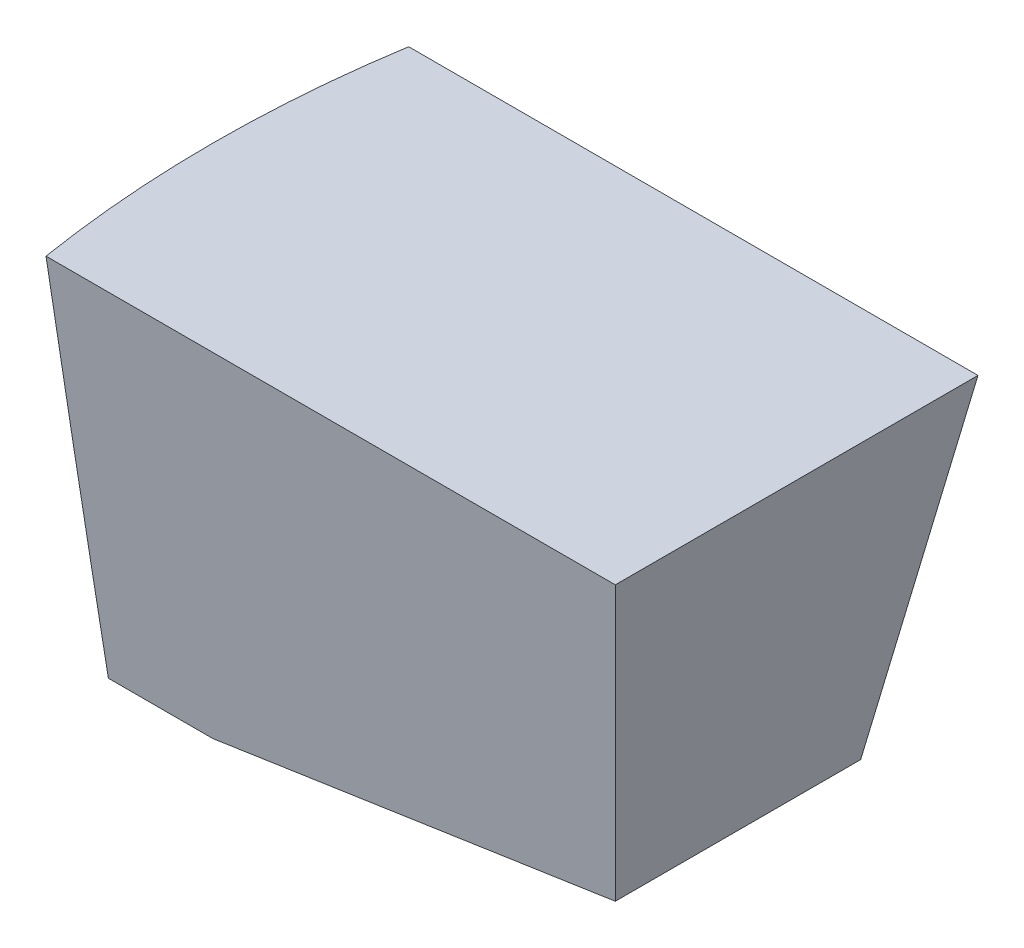
from build123d import *

# Parameters (mm, degrees)
TD_SKETCH_R                           = 0.79248
TL_FEATURE_DEPTH                      = 21.0312
TDF_180_DEG_REV_SKETCH_W              = 1.60495996
TDF_180_DEG_REV_SKETCH_H              = 1.60495996
TDF_180_DEG_REV_FEATURE_DEPTH         = 22.061040395
ISA_20_180_DEG_REV_FEATURE_DEPTH      = 22.061040395
ISA_20_180_DEG_REV_FEATURE_DEPTH_BACK = 22.061040395
F_10BA_180_DEG_REV_FEATURE_DEPTH      = 22.061040395
F_10BA_180_DEG_REV_FEATURE_DEPTH_BACK = 22.061040395


with BuildPart() as part:
    # TD_sketch → TL_feature (new body)
    with BuildSketch(Plane(origin=(0, 0, 0), x_dir=(1, 0, 0), z_dir=(0, 1, 0))):
        with Locations(Location((0, 0, 0), (0, 0, 270))):
            Circle(TD_SKETCH_R)
    extrude(amount=TL_FEATURE_DEPTH)

    # TDF_180_DEG_REV_sketch → TDF_180_DEG_REV_feature (cut, through all)
    with BuildSketch(Plane(origin=(0, 0, 0), x_dir=(1, 0, 0), z_dir=(0, 1, 0))):
        with Locations((1.17839998, 0)):
            Rectangle(TDF_180_DEG_REV_SKETCH_W, TDF_180_DEG_REV_SKETCH_H)
    extrude(amount=TDF_180_DEG_REV_FEATURE_DEPTH, mode=Mode.SUBTRACT)

    # ISA_20_180_DEG_REV_sketch → ISA_20_180_DEG_REV_feature (cut, two sides: drawn at the far end of the back side and taken through both)
    with BuildSketch(Plane(origin=(0, 0, 0), x_dir=(0, 0, -1), z_dir=(1, 0, 0)).offset(-ISA_20_180_DEG_REV_FEATURE_DEPTH_BACK)):
        Polygon((-12.996080373, 73.27228267), (-3.784567997, 21.0312), (-0.0762, 0), (0.0762, 0), (3.784567997, 21.0312), (12.996080373, 73.27228267), (12.996080373, -32.821688483), (-12.996080373, -32.821688483), align=None)
    extrude(amount=ISA_20_180_DEG_REV_FEATURE_DEPTH + ISA_20_180_DEG_REV_FEATURE_DEPTH_BACK, mode=Mode.SUBTRACT)

    # 10BA_180_DEG_REV_sketch → 10BA_180_DEG_REV_feature (cut, two sides: drawn at the far end of the back side and taken through both)
    with BuildSketch(Plane.XY.offset(-F_10BA_180_DEG_REV_FEATURE_DEPTH_BACK)):
        Polygon((-53.632984634, 0), (-0.79248, 0), (-0.71628, 0), (-0.427914365, 0.050846642), (3.271487997, 21.0312), (12.447145333, 73.068938636), (90.829329802, 2.18375769), (24.749199835, -70.885180946), align=None)
    extrude(amount=F_10BA_180_DEG_REV_FEATURE_DEPTH + F_10BA_180_DEG_REV_FEATURE_DEPTH_BACK, mode=Mode.SUBTRACT)

    # cut_feature
    split(bisect_by=Plane(origin=(0, 0.281844732, 0), x_dir=(1, 0, 0), z_dir=(0, 1, 0)), keep=Keep.BOTTOM)


solid = part.part
